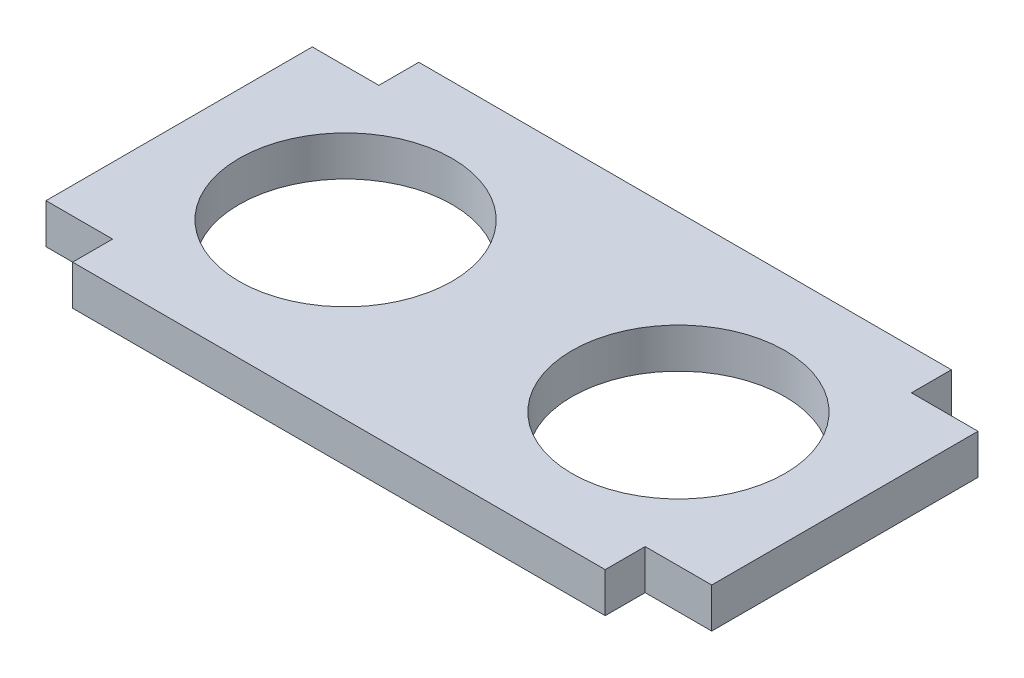
from build123d import *

# Parameters (mm, degrees)
EXTRUDE_1_DEPTH     = 3
SKETCH_2_R          = 8
CUT_EXTRUDE_1_DEPTH = 3


with BuildPart() as part:
    # 草图1 → 凸台-拉伸1 (new body)
    with BuildSketch(Plane(origin=(0, 0, 0), x_dir=(1, 0, 0), z_dir=(0, 1, 0))):
        Polygon((-20, 10), (-20, 13), (20, 13), (20, 10), (25, 10), (25, -10), (20, -10), (20, -13), (-20, -13), (-20, -10), (-25, -10), (-25, 10), align=None)
    extrude(amount=EXTRUDE_1_DEPTH)

    # 草图2 → 切除-拉伸1 (cut)
    with BuildSketch(Plane(origin=(0, 3, 0), x_dir=(1, 0, 0), z_dir=(0, 1, 0))):
        with Locations(Location((12.5, 0, 0), (0, 0, 270))):
            Circle(SKETCH_2_R)
        with Locations(Location((-12.5, 0, 0), (0, 0, 90))):
            Circle(SKETCH_2_R)
    extrude(amount=-CUT_EXTRUDE_1_DEPTH, mode=Mode.SUBTRACT)


solid = part.part
